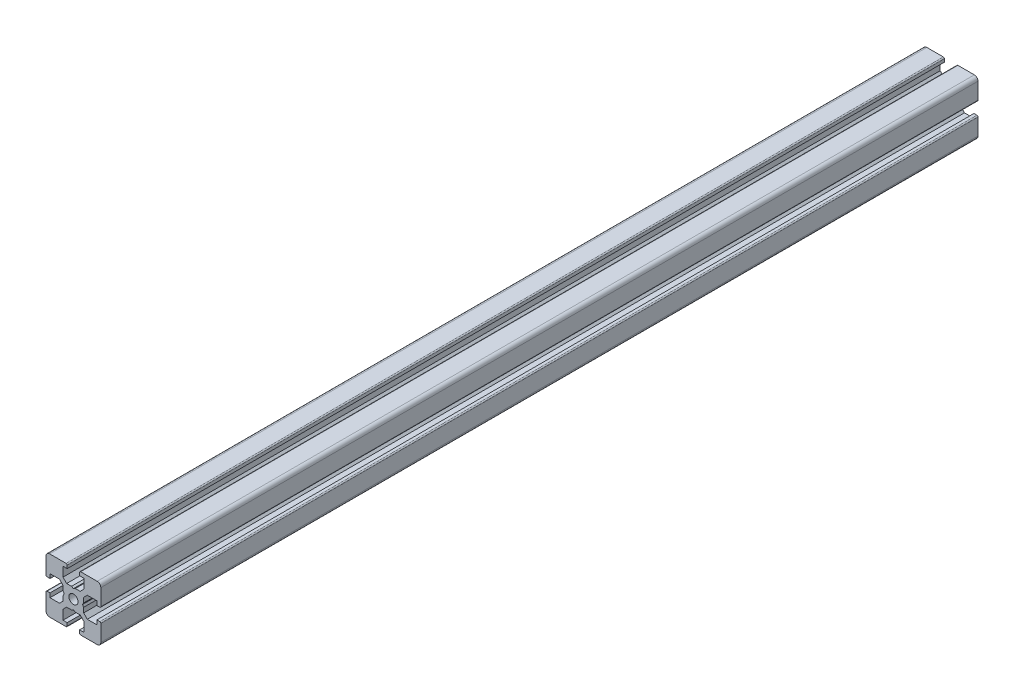
from build123d import *

# Parameters (mm, degrees)
SKETCH1_R           = 1.25
BOSS_EXTRUDE1_DEPTH = 240


with BuildPart() as part:
    # Sketch1 → Boss-Extrude1 (new body)
    with BuildSketch(Plane.XY.offset(300)):
        with BuildLine():
            Line((-7.5, 6.5), (-7.5, 2))
            ThreePointArc((-7.5, 2), (-7.412132034, 1.787867966), (-7.2, 1.7))
            Line((-7.2, 1.7), (-6.4, 1.7))
            Line((-6.4, 1.7), (-6.4, 2.85))
            Line((-6.4, 2.85), (-3.8, 2.85))
            Line((-3.8, 2.85), (-2.8, 1.85))
            Line((-2.8, 1.85), (-2.8, 0.519615242))
            Line((-2.8, 0.519615242), (-2.5, 0))
            Line((-2.5, 0), (-2.8, -0.519615242))
            Line((-2.8, -0.519615242), (-2.8, -1.85))
            Line((-2.8, -1.85), (-3.8, -2.85))
            Line((-3.8, -2.85), (-6.4, -2.85))
            Line((-6.4, -2.85), (-6.4, -1.7))
            Line((-6.4, -1.7), (-7.2, -1.7))
            ThreePointArc((-7.2, -1.7), (-7.412132034, -1.787867966), (-7.5, -2))
            Line((-7.5, -2), (-7.5, -6.5))
            ThreePointArc((-7.5, -6.5), (-7.207106781, -7.207106781), (-6.5, -7.5))
            Line((-6.5, -7.5), (-2, -7.5))
            ThreePointArc((-2, -7.5), (-1.787867966, -7.412132034), (-1.7, -7.2))
            Line((-1.7, -7.2), (-1.7, -6.4))
            Line((-1.7, -6.4), (-2.85, -6.4))
            Line((-2.85, -6.4), (-2.85, -3.8))
            Line((-2.85, -3.8), (-1.85, -2.8))
            Line((-1.85, -2.8), (-0.519615242, -2.8))
            Line((-0.519615242, -2.8), (0, -2.5))
            Line((0, -2.5), (0.519615242, -2.8))
            Line((0.519615242, -2.8), (1.85, -2.8))
            Line((1.85, -2.8), (2.85, -3.8))
            Line((2.85, -3.8), (2.85, -6.4))
            Line((2.85, -6.4), (1.7, -6.4))
            Line((1.7, -6.4), (1.7, -7.2))
            ThreePointArc((1.7, -7.2), (1.787867966, -7.412132034), (2, -7.5))
            Line((2, -7.5), (6.5, -7.5))
            ThreePointArc((6.5, -7.5), (7.207106781, -7.207106781), (7.5, -6.5))
            Line((7.5, -6.5), (7.5, -2))
            ThreePointArc((7.5, -2), (7.412132034, -1.787867966), (7.2, -1.7))
            Line((7.2, -1.7), (6.4, -1.7))
            Line((6.4, -1.7), (6.4, -2.85))
            Line((6.4, -2.85), (3.8, -2.85))
            Line((3.8, -2.85), (2.8, -1.85))
            Line((2.8, -1.85), (2.8, -0.519615242))
            Line((2.8, -0.519615242), (2.5, 0))
            Line((2.5, 0), (2.8, 0.519615242))
            Line((2.8, 0.519615242), (2.8, 1.85))
            Line((2.8, 1.85), (3.8, 2.85))
            Line((3.8, 2.85), (6.4, 2.85))
            Line((6.4, 2.85), (6.4, 1.7))
            Line((6.4, 1.7), (7.2, 1.7))
            ThreePointArc((7.2, 1.7), (7.412132034, 1.787867966), (7.5, 2))
            Line((7.5, 2), (7.5, 6.5))
            ThreePointArc((7.5, 6.5), (7.207106781, 7.207106781), (6.5, 7.5))
            Line((6.5, 7.5), (2, 7.5))
            ThreePointArc((2, 7.5), (1.787867966, 7.412132034), (1.7, 7.2))
            Line((1.7, 7.2), (1.7, 6.4))
            Line((1.7, 6.4), (2.85, 6.4))
            Line((2.85, 6.4), (2.85, 3.8))
            Line((2.85, 3.8), (1.85, 2.8))
            Line((1.85, 2.8), (0.519615242, 2.8))
            Line((0.519615242, 2.8), (0, 2.5))
            Line((0, 2.5), (-0.519615242, 2.8))
            Line((-0.519615242, 2.8), (-1.85, 2.8))
            Line((-1.85, 2.8), (-2.85, 3.8))
            Line((-2.85, 3.8), (-2.85, 6.4))
            Line((-2.85, 6.4), (-1.7, 6.4))
            Line((-1.7, 6.4), (-1.7, 7.2))
            ThreePointArc((-1.7, 7.2), (-1.787867966, 7.412132034), (-2, 7.5))
            Line((-2, 7.5), (-6.5, 7.5))
            ThreePointArc((-6.5, 7.5), (-7.207106781, 7.207106781), (-7.5, 6.5))
        make_face()
        with Locations(Location((0, 0, 0), (0, 0, 180))):
            Circle(SKETCH1_R, mode=Mode.SUBTRACT)
    extrude(amount=-BOSS_EXTRUDE1_DEPTH)


solid = part.part
